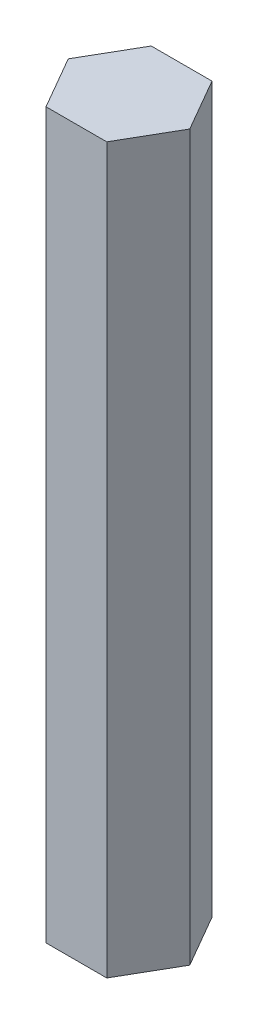
from build123d import *

# Parameters (mm, degrees)
BOSS_EXTRUDE1_DEPTH = 50


with BuildPart() as part:
    # Sketch1 → Boss-Extrude1 (new body)
    with BuildSketch(Plane(origin=(0, 0, 0), x_dir=(1, 0, 0), z_dir=(0, 1, 0))):
        Polygon((2.0975, 3.632976569), (-2.0975, 3.632976569), (-4.195, 0), (-2.0975, -3.632976569), (2.0975, -3.632976569), (4.195, 0), align=None)
    extrude(amount=-BOSS_EXTRUDE1_DEPTH)


solid = part.part
